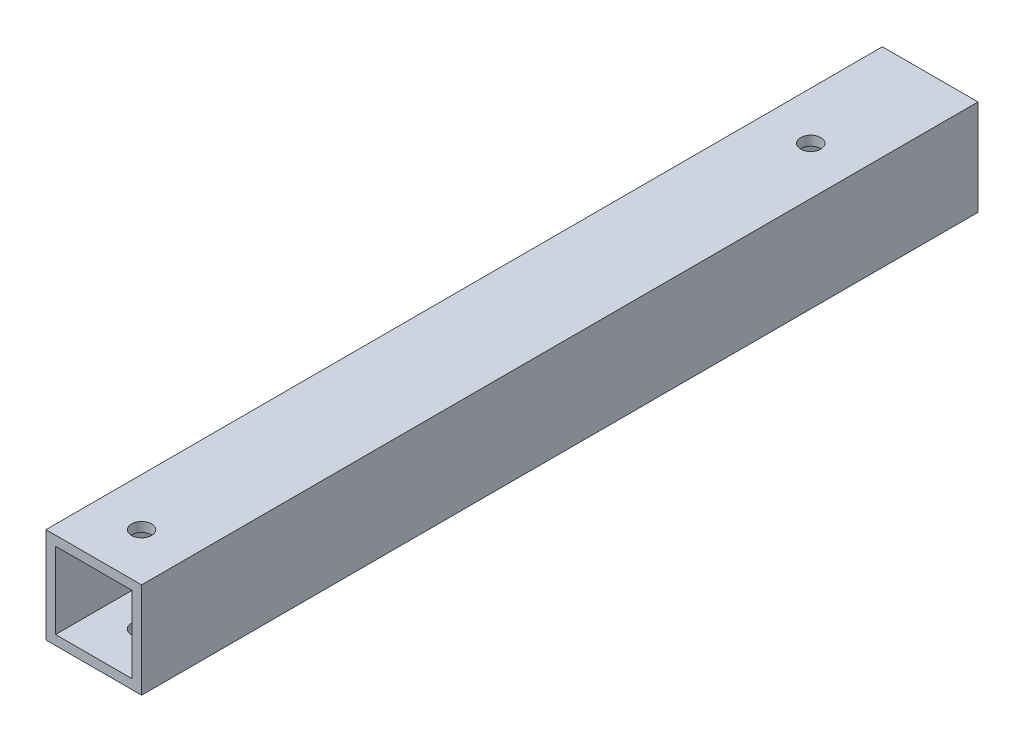
from build123d import *

# Parameters (mm, degrees)
SKETCH_1_W          = 20
SKETCH_1_H          = 20
SKETCH_1_W_2        = 16
SKETCH_1_H_2        = 16
EXTRUDE_1_DEPTH     = 175
SKETCH_2_R          = 2.1
CUT_EXTRUDE_1_DEPTH = 177.422787644


with BuildPart() as part:
    # 草图1 → 凸台-拉伸1 (new body)
    with BuildSketch(Plane.XY):
        Rectangle(SKETCH_1_W, SKETCH_1_H)
        Rectangle(SKETCH_1_W_2, SKETCH_1_H_2, mode=Mode.SUBTRACT)
    extrude(amount=EXTRUDE_1_DEPTH)

    # 草图2 → 切除-拉伸1 (cut, through all)
    with BuildSketch(Plane(origin=(0, 10, 0), x_dir=(1, 0, 0), z_dir=(0, 1, 0))):
        with Locations(Location((0, -165, 0), (0, 0, 270))):
            Circle(SKETCH_2_R)
        with Locations(Location((0, -25, 0), (0, 0, 270))):
            Circle(SKETCH_2_R)
    extrude(amount=-CUT_EXTRUDE_1_DEPTH, mode=Mode.SUBTRACT)


solid = part.part
